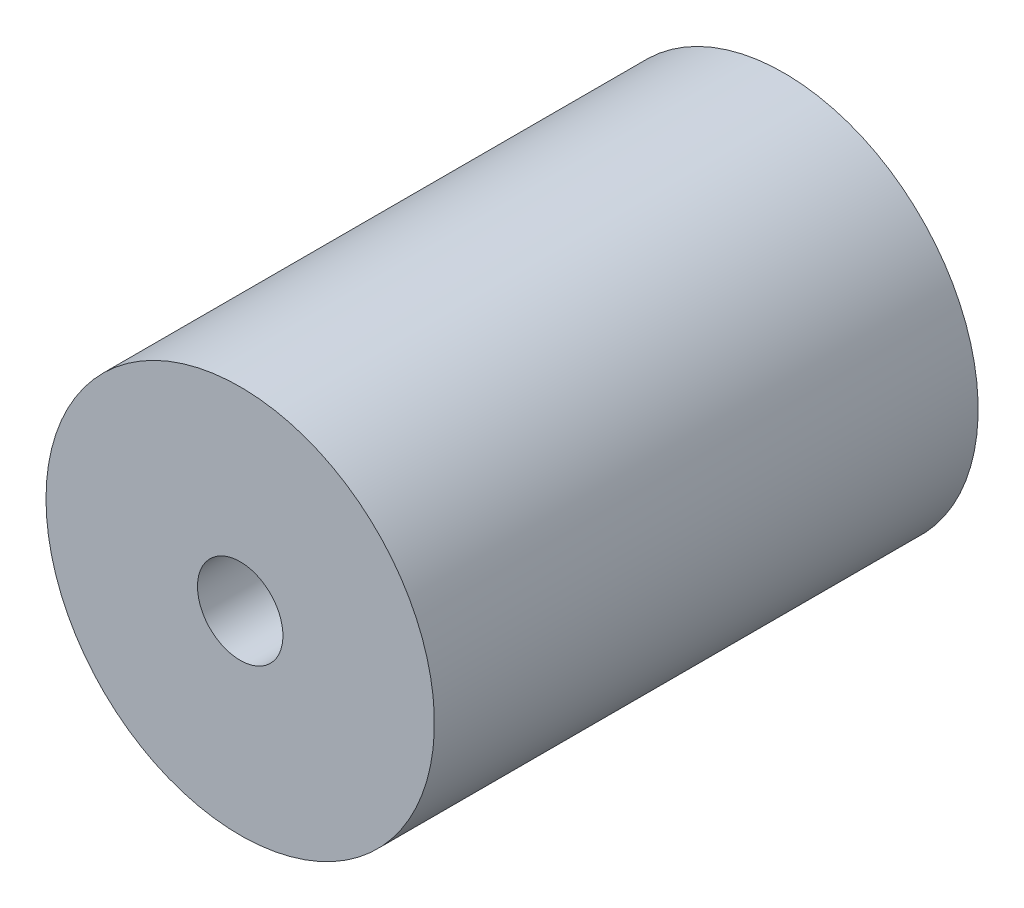
from build123d import *

# Parameters (mm, degrees)
ESBO_O1_R                = 7.5
ESBO_O1_R_2              = 1.65
RESSALTO_EXTRUS_O1_DEPTH = 21


with BuildPart() as part:
    # Esboço1 → Ressalto-extrusão1 (new body)
    with BuildSketch(Plane.XY):
        with Locations(Location((0, 0, 0), (0, 0, 180))):
            Circle(ESBO_O1_R)
        with Locations(Location((0, 0, 0), (0, 0, 180))):
            Circle(ESBO_O1_R_2, mode=Mode.SUBTRACT)
    extrude(amount=RESSALTO_EXTRUS_O1_DEPTH)


solid = part.part
